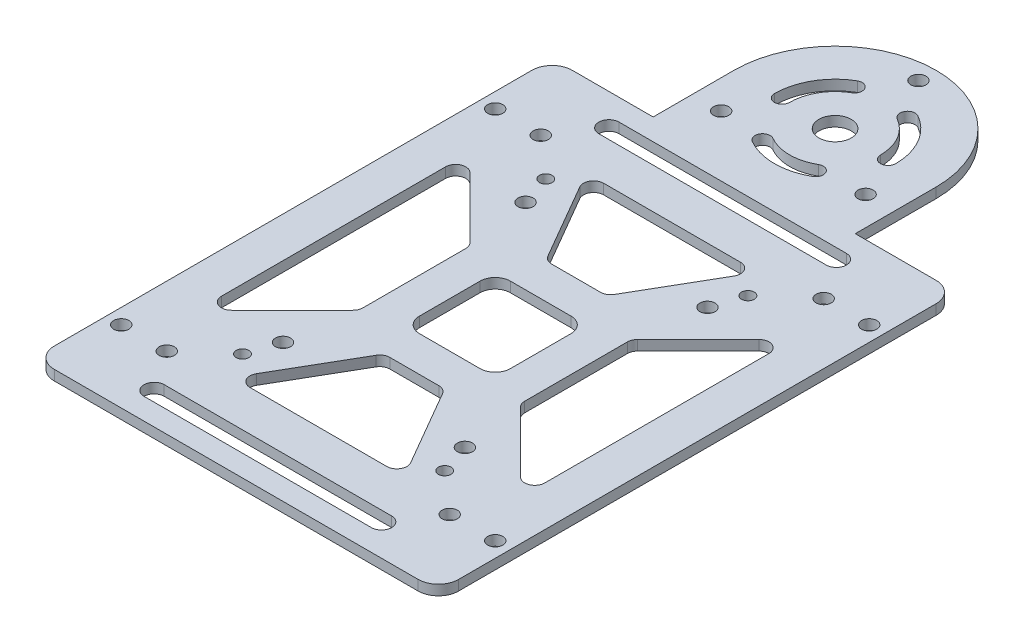
from build123d import *

# Parameters (mm, degrees)
SKETCH_1_R      = 1.5
SKETCH_1_R_2    = 1.25
SKETCH_1_R_3    = 3.2
EXTRUDE_1_DEPTH = 2


with BuildPart() as part:
    # 草图1 → 凸台-拉伸1 (new body)
    with BuildSketch(Plane(origin=(0, 0, 0), x_dir=(1, 0, 0), z_dir=(0, 1, 0))):
        with BuildLine():
            Line((-20, 67.25), (-20, 51.25))
            Line((-20, 51.25), (-36, 51.25))
            ThreePointArc((-36, 51.25), (-38.828427125, 50.078427125), (-40, 47.25))
            Line((-40, 47.25), (-40, -47.25))
            ThreePointArc((-40, -47.25), (-38.828427125, -50.078427125), (-36, -51.25))
            Line((-36, -51.25), (36, -51.25))
            ThreePointArc((36, -51.25), (38.828427125, -50.078427125), (40, -47.25))
            Line((40, -47.25), (40, 47.25))
            ThreePointArc((40, 47.25), (38.828427125, 50.078427125), (36, 51.25))
            Line((36, 51.25), (20, 51.25))
            Line((20, 51.25), (20, 67.25))
            ThreePointArc((20, 67.25), (0, 87.25), (-20, 67.25))
        make_face()
        with Locations(Location((-28, 37, 0), (0, 0, 270))):
            Circle(SKETCH_1_R, mode=Mode.SUBTRACT)
        with Locations(Location((28, 37, 0), (0, 0, 270))):
            Circle(SKETCH_1_R, mode=Mode.SUBTRACT)
        with Locations(Location((-28, -37, 0), (0, 0, 270))):
            Circle(SKETCH_1_R, mode=Mode.SUBTRACT)
        with Locations(Location((28, -37, 0), (0, 0, 270))):
            Circle(SKETCH_1_R, mode=Mode.SUBTRACT)
        with Locations(Location((-20, 30, 0), (0, 0, 270))):
            Circle(SKETCH_1_R_2, mode=Mode.SUBTRACT)
        with Locations(Location((20, 30, 0), (0, 0, 270))):
            Circle(SKETCH_1_R_2, mode=Mode.SUBTRACT)
        with Locations(Location((-20, -30, 0), (0, 0, 270))):
            Circle(SKETCH_1_R_2, mode=Mode.SUBTRACT)
        with Locations(Location((20, -30, 0), (0, 0, 270))):
            Circle(SKETCH_1_R_2, mode=Mode.SUBTRACT)
        with Locations(Location((37, -37, 0), (0, 0, 270))):
            Circle(SKETCH_1_R, mode=Mode.SUBTRACT)
        with Locations(Location((-37, -37, 0), (0, 0, 270))):
            Circle(SKETCH_1_R, mode=Mode.SUBTRACT)
        with Locations(Location((-37, 37, 0), (0, 0, 270))):
            Circle(SKETCH_1_R, mode=Mode.SUBTRACT)
        with Locations(Location((37, 37, 0), (0, 0, 270))):
            Circle(SKETCH_1_R, mode=Mode.SUBTRACT)
        with Locations(Location((0, 67.25, 0), (0, 0, 270))):
            Circle(SKETCH_1_R_3, mode=Mode.SUBTRACT)
        with Locations(Location((0, 83.75, 0), (0, 0, 270))):
            Circle(SKETCH_1_R, mode=Mode.SUBTRACT)
        with Locations(Location((14.289419162, 59, 0), (0, 0, 270))):
            Circle(SKETCH_1_R, mode=Mode.SUBTRACT)
        with Locations(Location((-14.289419162, 59, 0), (0, 0, 270))):
            Circle(SKETCH_1_R, mode=Mode.SUBTRACT)
        with Locations(Location((-18, 24, 0), (0, 0, 270))):
            Circle(SKETCH_1_R, mode=Mode.SUBTRACT)
        with Locations(Location((18, 24, 0), (0, 0, 270))):
            Circle(SKETCH_1_R, mode=Mode.SUBTRACT)
        with Locations(Location((-18, -24, 0), (0, 0, 270))):
            Circle(SKETCH_1_R, mode=Mode.SUBTRACT)
        with Locations(Location((18, -24, 0), (0, 0, 270))):
            Circle(SKETCH_1_R, mode=Mode.SUBTRACT)
        with BuildLine():
            Line((-22.5, 47), (22.5, 47))
            ThreePointArc((22.5, 47), (24.5, 45), (22.5, 43))
            Line((22.5, 43), (-22.5, 43))
            ThreePointArc((-22.5, 43), (-24.5, 45), (-22.5, 47))
        make_face(mode=Mode.SUBTRACT)
        with BuildLine():
            Line((-13.531105432, 35), (13.531105432, 35))
            ThreePointArc((13.531105432, 35), (15.263754427, 33.998963192), (15.261958003, 31.997927459))
            Line((15.261958003, 31.997927459), (6.577747476, 16.997927459))
            ThreePointArc((6.577747476, 16.997927459), (5.845858097, 16.267351005), (4.846894905, 16))
            Line((4.846894905, 16), (-4.846894905, 16))
            ThreePointArc((-4.846894905, 16), (-5.845858097, 16.267351005), (-6.577747476, 16.997927459))
            Line((-6.577747476, 16.997927459), (-15.261958003, 31.997927459))
            ThreePointArc((-15.261958003, 31.997927459), (-15.263754427, 33.998963192), (-13.531105432, 35))
        make_face(mode=Mode.SUBTRACT)
        with BuildLine():
            Line((16.585786438, 11.585786438), (28.585786438, 23.585786438))
            ThreePointArc((28.585786438, 23.585786438), (30.765366865, 24.01933194), (32, 22.171572875))
            Line((32, 22.171572875), (32, -22.171572875))
            ThreePointArc((32, -22.171572875), (30.765366865, -24.01933194), (28.585786438, -23.585786438))
            Line((28.585786438, -23.585786438), (16.585786438, -11.585786438))
            ThreePointArc((16.585786438, -11.585786438), (16.152240935, -10.93693974), (16, -10.171572875))
            Line((16, -10.171572875), (16, 10.171572875))
            ThreePointArc((16, 10.171572875), (16.152240935, 10.93693974), (16.585786438, 11.585786438))
        make_face(mode=Mode.SUBTRACT)
        with BuildLine():
            Line((4.846894905, -16), (-4.846894905, -16))
            ThreePointArc((-4.846894905, -16), (-5.845858097, -16.267351005), (-6.577747476, -16.997927459))
            Line((-6.577747476, -16.997927459), (-15.261958003, -31.997927459))
            ThreePointArc((-15.261958003, -31.997927459), (-15.263754427, -33.998963192), (-13.531105432, -35))
            Line((-13.531105432, -35), (13.531105432, -35))
            ThreePointArc((13.531105432, -35), (15.263754427, -33.998963192), (15.261958003, -31.997927459))
            Line((15.261958003, -31.997927459), (6.577747476, -16.997927459))
            ThreePointArc((6.577747476, -16.997927459), (5.845858097, -16.267351005), (4.846894905, -16))
        make_face(mode=Mode.SUBTRACT)
        with BuildLine():
            Line((-16.585786438, -11.585786438), (-28.585786438, -23.585786438))
            ThreePointArc((-28.585786438, -23.585786438), (-30.765366865, -24.01933194), (-32, -22.171572875))
            Line((-32, -22.171572875), (-32, 22.171572875))
            ThreePointArc((-32, 22.171572875), (-30.765366865, 24.01933194), (-28.585786438, 23.585786438))
            Line((-28.585786438, 23.585786438), (-16.585786438, 11.585786438))
            ThreePointArc((-16.585786438, 11.585786438), (-16.152240935, 10.93693974), (-16, 10.171572875))
            Line((-16, 10.171572875), (-16, -10.171572875))
            ThreePointArc((-16, -10.171572875), (-16.152240935, -10.93693974), (-16.585786438, -11.585786438))
        make_face(mode=Mode.SUBTRACT)
        with BuildLine():
            Line((-6, -9), (6, -9))
            ThreePointArc((6, -9), (8.121320344, -8.121320344), (9, -6))
            Line((9, -6), (9, 6))
            ThreePointArc((9, 6), (8.121320344, 8.121320344), (6, 9))
            Line((6, 9), (-6, 9))
            ThreePointArc((-6, 9), (-8.121320344, 8.121320344), (-9, 6))
            Line((-9, 6), (-9, -6))
            ThreePointArc((-9, -6), (-8.121320344, -8.121320344), (-6, -9))
        make_face(mode=Mode.SUBTRACT)
        with BuildLine():
            Line((-22.5, -43), (22.5, -43))
            ThreePointArc((22.5, -43), (24.5, -45), (22.5, -47))
            Line((22.5, -47), (-22.5, -47))
            ThreePointArc((-22.5, -47), (-24.5, -45), (-22.5, -43))
        make_face(mode=Mode.SUBTRACT)
        with BuildLine():
            ThreePointArc((4.5, 75.044228634), (7.794228634, 71.75), (9, 67.25))
            ThreePointArc((9, 67.25), (10.5, 65.75), (12, 67.25))
            ThreePointArc((12, 67.25), (10.392304845, 73.25), (6, 77.642304845))
            ThreePointArc((6, 77.642304845), (3.950961894, 77.09326674), (4.5, 75.044228634))
        make_face(mode=Mode.SUBTRACT)
        with BuildLine():
            ThreePointArc((-6, 56.857695155), (-6.549038106, 58.90673326), (-4.5, 59.455771366))
            ThreePointArc((-4.5, 59.455771366), (0, 58.25), (4.5, 59.455771366))
            ThreePointArc((4.5, 59.455771366), (6.549038106, 58.90673326), (6, 56.857695155))
            ThreePointArc((6, 56.857695155), (0, 55.25), (-6, 56.857695155))
        make_face(mode=Mode.SUBTRACT)
        with BuildLine():
            ThreePointArc((-6, 77.642304845), (-3.950961894, 77.09326674), (-4.5, 75.044228634))
            ThreePointArc((-4.5, 75.044228634), (-7.794228634, 71.75), (-9, 67.25))
            ThreePointArc((-9, 67.25), (-10.5, 65.75), (-12, 67.25))
            ThreePointArc((-12, 67.25), (-10.392304845, 73.25), (-6, 77.642304845))
        make_face(mode=Mode.SUBTRACT)
    extrude(amount=EXTRUDE_1_DEPTH)


solid = part.part
